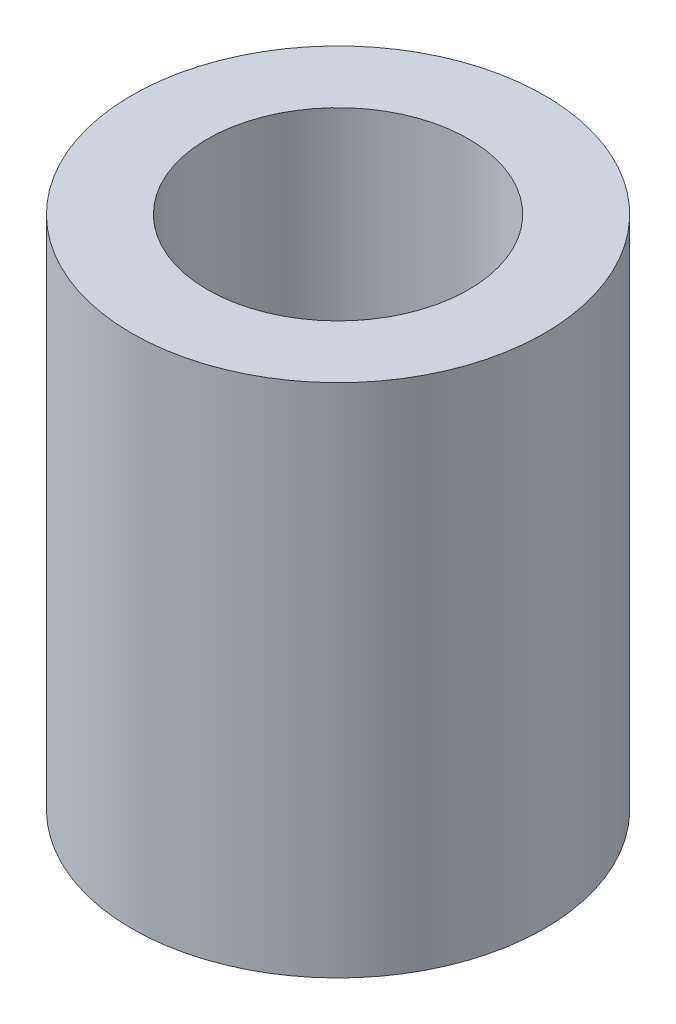
from build123d import *

# Parameters (mm, degrees)
SKETCH1_R           = 3
SKETCH1_R_2         = 1.9
BOSS_EXTRUDE1_DEPTH = 7.5


with BuildPart() as part:
    # Sketch1 → Boss-Extrude1 (new body)
    with BuildSketch(Plane(origin=(0, 0, 0), x_dir=(1, 0, 0), z_dir=(0, 1, 0))):
        with Locations(Location((0, 0, 0), (0, 0, 270))):
            Circle(SKETCH1_R)
        with Locations(Location((0, 0, 0), (0, 0, 270))):
            Circle(SKETCH1_R_2, mode=Mode.SUBTRACT)
    extrude(amount=BOSS_EXTRUDE1_DEPTH)


solid = part.part
